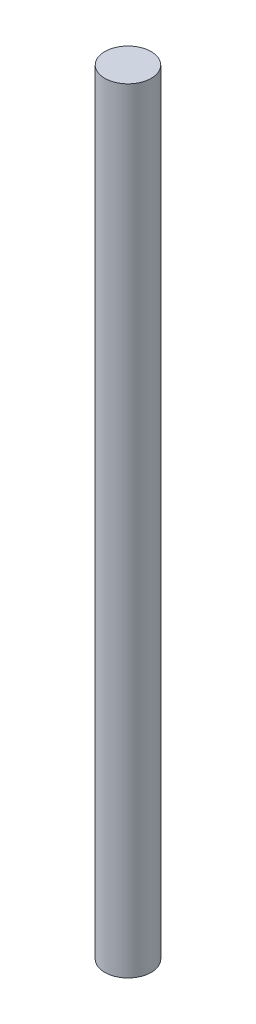
from build123d import *

# Parameters (mm, degrees)
SKETCH_1_R      = 1
EXTRUDE_1_DEPTH = 33.4


with BuildPart() as part:
    # 草图1 → 凸台-拉伸1 (new body)
    with BuildSketch(Plane(origin=(0, 0, 0), x_dir=(1, 0, 0), z_dir=(0, 1, 0))):
        with Locations(Location((0, 0, 0), (0, 0, 270))):
            Circle(SKETCH_1_R)
    extrude(amount=EXTRUDE_1_DEPTH)


solid = part.part
